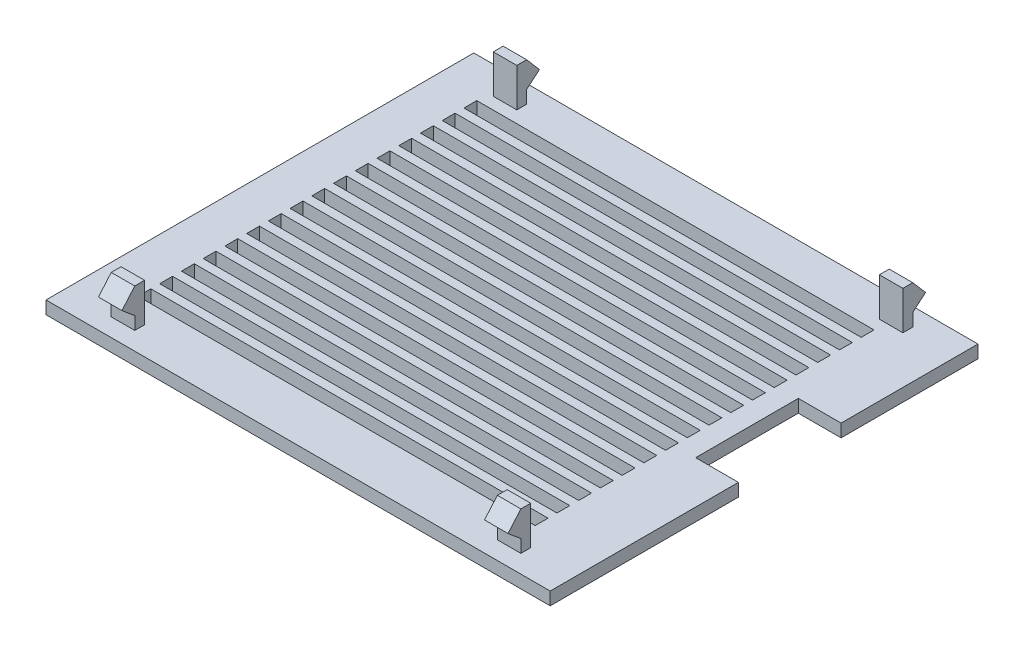
from build123d import *

# Parameters (mm, degrees)
SKETCH1_W               = 117.85
SKETCH1_H               = 100
BOSS_EXTRUDE1_DEPTH     = 3
BOSS_EXTRUDE2_DEPTH     = 117.85
SKETCH3_W               = 10
SKETCH3_H               = 24
CUT_EXTRUDE1_DEPTH      = 3
CUT_EXTRUDE2_DEPTH      = 129.579245993
CUT_EXTRUDE2_DEPTH_BACK = 129.579245993
SKETCH4_W               = 11.05
SKETCH4_H               = 9
SKETCH4_W_2             = 84.75
SKETCH5_W               = 92.85
SKETCH5_H               = 3
CUT_EXTRUDE3_DEPTH      = 3


with BuildPart() as part:
    # Sketch1 → Boss-Extrude1 (new body)
    with BuildSketch(Plane(origin=(0, 0, 0), x_dir=(1, 0, 0), z_dir=(0, 1, 0))):
        with Locations((58.925, 50)):
            Rectangle(SKETCH1_W, SKETCH1_H)
    extrude(amount=BOSS_EXTRUDE1_DEPTH)

    # Sketch2 → Boss-Extrude2 (add)
    with BuildSketch(Plane(origin=(117.85, 0, 0), x_dir=(0, 0, -1), z_dir=(1, 0, 0))):
        Polygon((4.2, 6), (4.2, 3), (6.5, 3), (6.5, 12), (4.2, 12), align=None)
        Polygon((4.2, 12), (4.2, 6), (1.2, 8.517298894), align=None)
    boss_extrude2 = extrude(amount=-BOSS_EXTRUDE2_DEPTH)

    # Sketch3 → Cut-Extrude1 (cut)
    with BuildSketch(Plane.XZ):
        with Locations((112.85, -56)):
            Rectangle(SKETCH3_W, SKETCH3_H)
    extrude(amount=-CUT_EXTRUDE1_DEPTH, mode=Mode.SUBTRACT)

    # Mirror1: Boss-Extrude2 across plane
    add(boss_extrude2.mirror(Plane.XY.offset(-50)))

    # Sketch4 → Cut-Extrude2 (cut, two sides: drawn at the far end of the back side and taken through both)
    with BuildSketch(Plane.XY.offset(-50).offset(-CUT_EXTRUDE2_DEPTH_BACK)):
        with Locations((5.525, 7.5)):
            Rectangle(SKETCH4_W, SKETCH4_H)
        with Locations((112.325, 7.5)):
            Rectangle(SKETCH4_W, SKETCH4_H)
        with Locations((58.925, 7.5)):
            Rectangle(SKETCH4_W_2, SKETCH4_H)
    extrude(amount=CUT_EXTRUDE2_DEPTH + CUT_EXTRUDE2_DEPTH_BACK, mode=Mode.SUBTRACT)

    # Sketch5 → Cut-Extrude3 (cut)
    with BuildSketch(Plane(origin=(0, 0, 0), x_dir=(-1, 0, 0), z_dir=(0, -1, 0))):
        with Locations((-56.425, 13)):
            Rectangle(SKETCH5_W, SKETCH5_H)
        with Locations((-56.425, 18.08)):
            Rectangle(SKETCH5_W, SKETCH5_H)
        with Locations((-56.425, 23.16)):
            Rectangle(SKETCH5_W, SKETCH5_H)
        with Locations((-56.425, 28.24)):
            Rectangle(SKETCH5_W, SKETCH5_H)
        with Locations((-56.425, 33.32)):
            Rectangle(SKETCH5_W, SKETCH5_H)
        with Locations((-56.425, 38.4)):
            Rectangle(SKETCH5_W, SKETCH5_H)
        with Locations((-56.425, 43.48)):
            Rectangle(SKETCH5_W, SKETCH5_H)
        with Locations((-56.425, 48.56)):
            Rectangle(SKETCH5_W, SKETCH5_H)
        with Locations((-56.425, 53.64)):
            Rectangle(SKETCH5_W, SKETCH5_H)
        with Locations((-56.425, 58.72)):
            Rectangle(SKETCH5_W, SKETCH5_H)
        with Locations((-56.425, 63.8)):
            Rectangle(SKETCH5_W, SKETCH5_H)
        with Locations((-56.425, 68.88)):
            Rectangle(SKETCH5_W, SKETCH5_H)
        with Locations((-56.425, 73.96)):
            Rectangle(SKETCH5_W, SKETCH5_H)
        with Locations((-56.425, 79.04)):
            Rectangle(SKETCH5_W, SKETCH5_H)
        with Locations((-56.425, 84.12)):
            Rectangle(SKETCH5_W, SKETCH5_H)
        with Locations((-56.425, 89.2)):
            Rectangle(SKETCH5_W, SKETCH5_H)
    extrude(amount=-CUT_EXTRUDE3_DEPTH, mode=Mode.SUBTRACT)


solid = part.part
